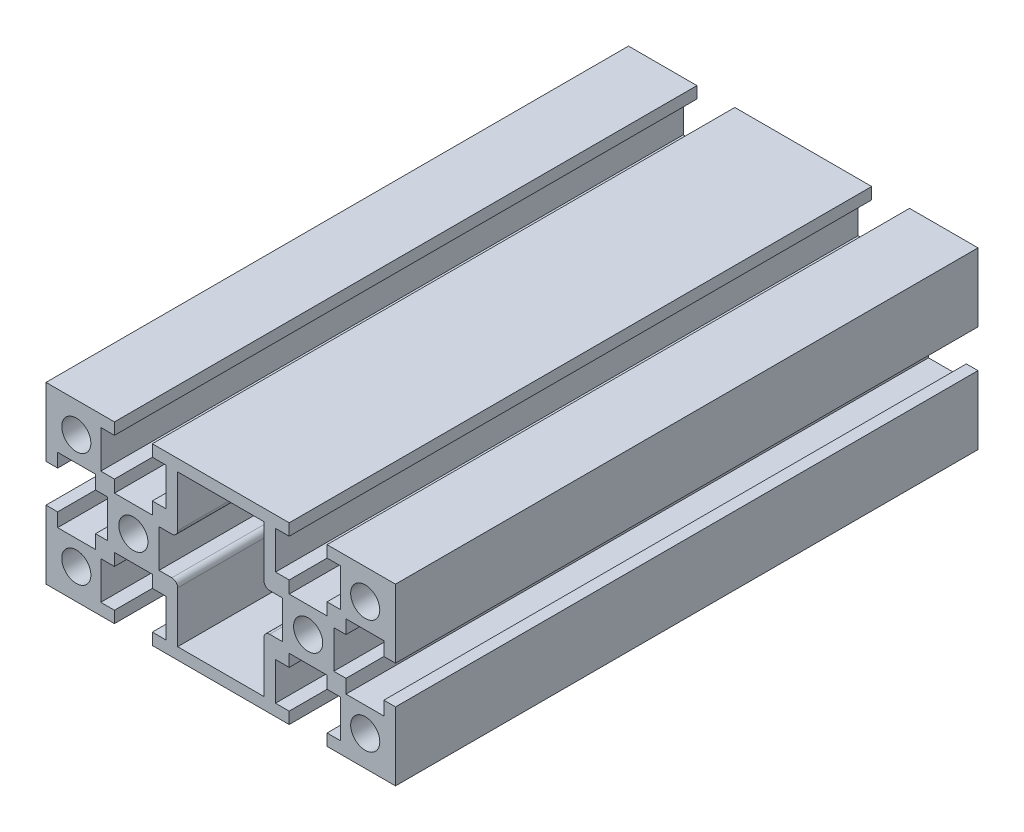
from build123d import *

# Parameters (mm, degrees)
SKETCH_1_R      = 2.5
EXTRUDE_1_DEPTH = 100


with BuildPart() as part:
    # 草图1 → 凸台-拉伸1 (new body)
    with BuildSketch(Plane.XY):
        Polygon((-15, 15), (-3.25, 15), (-3.25, 13), (-5.6, 13), (-5.6, 6.5), (-3.25, 6.5), (-3.25, 4.4), (3.25, 4.4), (3.25, 6.5), (5.6, 6.5), (5.6, 13), (3.25, 13), (3.25, 15), (26.75, 15), (26.75, 13), (24.4, 13), (24.4, 6.5), (26.75, 6.5), (26.75, 4.4), (33.25, 4.4), (33.25, 6.5), (35.6, 6.5), (35.6, 13), (33.25, 13), (33.25, 15), (45, 15), (45, 3.25), (43, 3.25), (43, 5.6), (36.5, 5.6), (36.5, 3.25), (34.4, 3.25), (34.4, -3.25), (36.5, -3.25), (36.5, -5.6), (43, -5.6), (43, -3.25), (45, -3.25), (45, -15), (33.25, -15), (33.25, -13), (35.6, -13), (35.6, -6.5), (33.25, -6.5), (33.25, -4.4), (26.75, -4.4), (26.75, -6.5), (24.4, -6.5), (24.4, -13), (26.75, -13), (26.75, -15), (3.25, -15), (3.25, -13), (5.6, -13), (5.6, -6.5), (3.25, -6.5), (3.25, -4.4), (-3.25, -4.4), (-3.25, -6.5), (-5.6, -6.5), (-5.6, -13), (-3.25, -13), (-3.25, -15), (-15, -15), (-15, -3.25), (-13, -3.25), (-13, -5.6), (-6.5, -5.6), (-6.5, -3.25), (-4.4, -3.25), (-4.4, 3.25), (-6.5, 3.25), (-6.5, 5.6), (-13, 5.6), (-13, 3.25), (-15, 3.25), align=None)
        Circle(SKETCH_1_R, mode=Mode.SUBTRACT)
        with Locations((30, 0)):
            Circle(SKETCH_1_R, mode=Mode.SUBTRACT)
        with Locations((39.8, 9.8)):
            Circle(SKETCH_1_R, mode=Mode.SUBTRACT)
        with Locations((39.8, -9.8)):
            Circle(SKETCH_1_R, mode=Mode.SUBTRACT)
        with Locations((-9.8, 9.8)):
            Circle(SKETCH_1_R, mode=Mode.SUBTRACT)
        with Locations((-9.8, -9.8)):
            Circle(SKETCH_1_R, mode=Mode.SUBTRACT)
        with BuildLine():
            Line((7.6, 13), (7.6, 4.25))
            ThreePointArc((7.6, 4.25), (7.307106781, 3.542893219), (6.6, 3.25))
            Line((6.6, 3.25), (4.4, 3.25))
            Line((4.4, 3.25), (4.4, -3.25))
            Line((4.4, -3.25), (6.6, -3.25))
            ThreePointArc((6.6, -3.25), (7.307106781, -3.542893219), (7.6, -4.25))
            Line((7.6, -4.25), (7.6, -13))
            Line((7.6, -13), (22.4, -13))
            Line((22.4, -13), (22.4, -4.25))
            ThreePointArc((22.4, -4.25), (22.692893219, -3.542893219), (23.4, -3.25))
            Line((23.4, -3.25), (25.6, -3.25))
            Line((25.6, -3.25), (25.6, 3.25))
            Line((25.6, 3.25), (23.4, 3.25))
            ThreePointArc((23.4, 3.25), (22.692893219, 3.542893219), (22.4, 4.25))
            Line((22.4, 4.25), (22.4, 13))
            Line((22.4, 13), (7.6, 13))
        make_face(mode=Mode.SUBTRACT)
    extrude(amount=EXTRUDE_1_DEPTH)


solid = part.part
